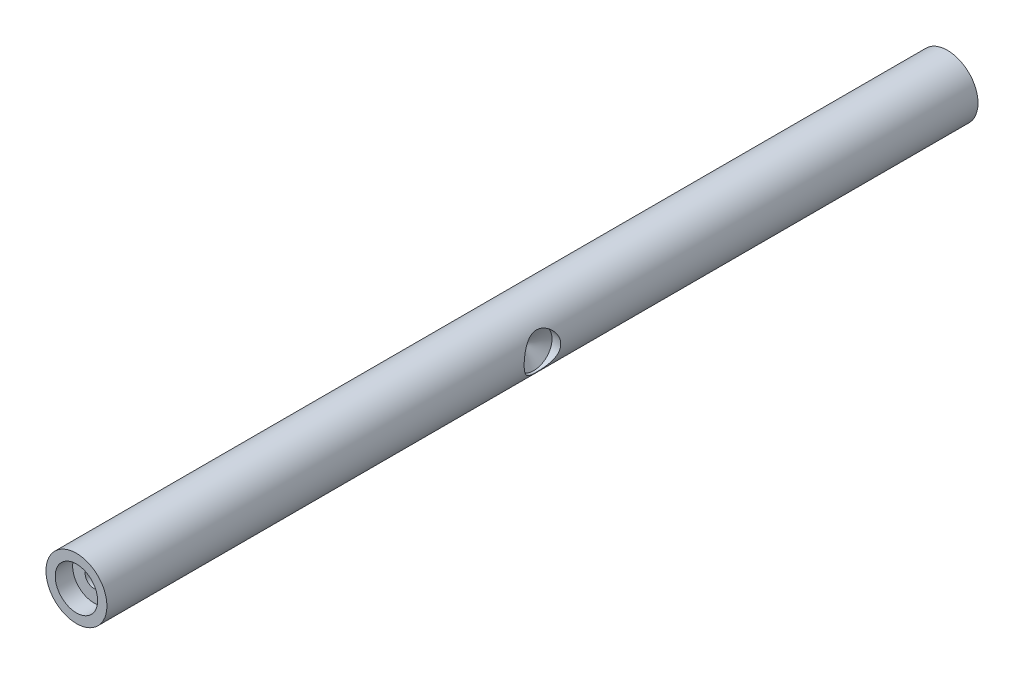
from build123d import *

# Parameters (mm, degrees)
SCHIZZO1_R                   = 7
ESTRUSIONE_ESTRUSIONE1_DEPTH = 100
TAGLIO_ESTRUSIONE1_REACH     = 202.245
SCHIZZO2_R                   = 2
SCHIZZO5_R                   = 4.87
TAGLIO_ESTRUSIONE2_DEPTH     = 4
FORO_PER_VITE_M8_1_D         = 8.4
FORO_PER_VITE_M8_1_DEPTH     = 2
FORO_PER_VITE_M8_1_TIP       = 2.5236146


with BuildPart() as part:
    # Schizzo1 → Estrusione-Estrusione1 (new, symmetric)
    with BuildSketch(Plane.XY):
        Circle(SCHIZZO1_R)
    extrude(amount=ESTRUSIONE_ESTRUSIONE1_DEPTH, both=True)

    # Schizzo2 → Taglio-Estrusione1 (cut, up to next)
    with BuildSketch(Plane.XY.offset(100), mode=Mode.PRIVATE) as taglio_estrusione1_sk1:
        Circle(SCHIZZO2_R)
    taglio_estrusione1_tool1 = extrude(taglio_estrusione1_sk1.sketch, amount=-TAGLIO_ESTRUSIONE1_REACH, mode=Mode.PRIVATE) & part.part
    add(taglio_estrusione1_tool1.solids().sort_by_distance((0, 0, 100))[0], mode=Mode.SUBTRACT)

    # Schizzo5 → Taglio-Estrusione2 (cut)
    with BuildSketch(Plane.XY.offset(100)):
        Circle(SCHIZZO5_R)
    extrude(amount=-TAGLIO_ESTRUSIONE2_DEPTH, mode=Mode.SUBTRACT)

    # Foro per Vite M8-1
    with Locations(Plane(origin=(7, 0, 0), x_dir=(0, 0, -1), z_dir=(1, 0, 0))):
        with Locations((0, 0)):
            Hole(FORO_PER_VITE_M8_1_D / 2, depth=FORO_PER_VITE_M8_1_DEPTH)
            with Locations((0, 0, -(FORO_PER_VITE_M8_1_DEPTH + FORO_PER_VITE_M8_1_TIP / 2))):  # 118° drill point
                Cone(0, FORO_PER_VITE_M8_1_D / 2, FORO_PER_VITE_M8_1_TIP, mode=Mode.SUBTRACT)


solid = part.part
